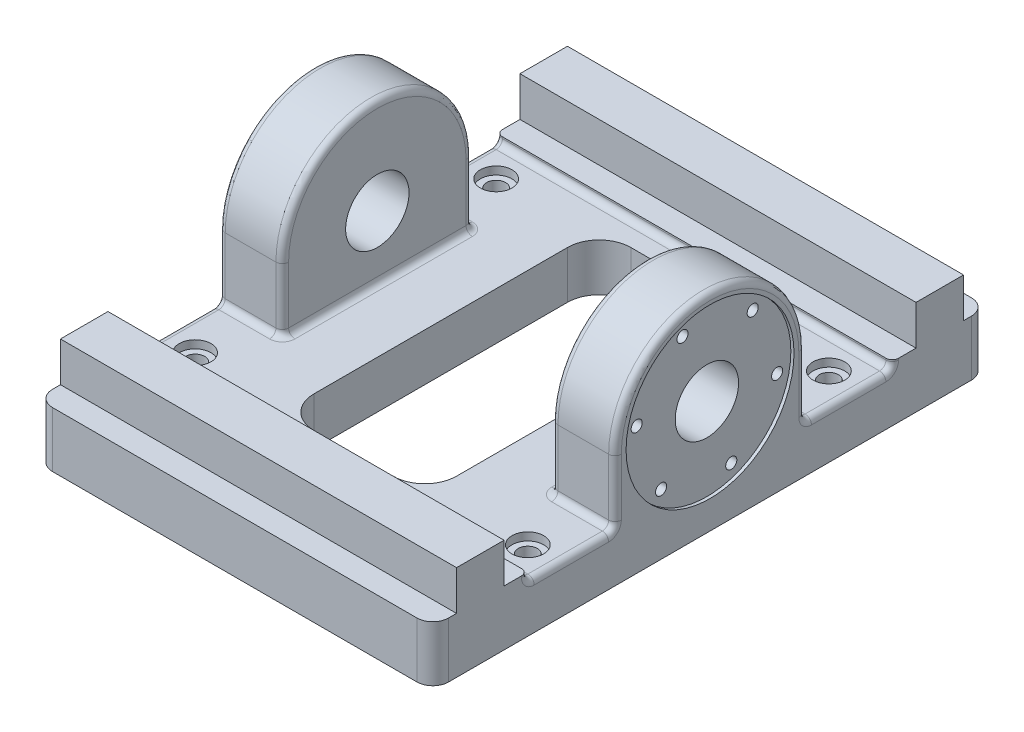
from build123d import *

# Parameters (mm, degrees)
SKETCH1_W               = 250
SKETCH1_H               = 350
BOSS_EXTRUDE1_DEPTH     = 30
SKETCH2_W               = 250
SKETCH2_H               = 30
BOSS_EXTRUDE2_DEPTH     = 30
SKETCH3_W               = 250
SKETCH3_H               = 60
BOSS_EXTRUDE3_DEPTH     = 5
BOSS_EXTRUDE4_DEPTH     = 40
SKETCH5_R               = 53
CUT_EXTRUDE1_DEPTH      = 2
SKETCH6_R               = 3.5
CUT_EXTRUDE2_DEPTH      = 30
CIRPATTERN1_COUNT       = 6
MIRROR2_COPY_1_SKETCH_R = 3.5
MIRROR2_COPY_1_DEPTH    = 30
MIRROR2_COPY_2_SKETCH_R = 3.5
MIRROR2_COPY_2_DEPTH    = 30
MIRROR2_COPY_3_SKETCH_R = 3.5
MIRROR2_COPY_3_DEPTH    = 30
MIRROR2_COPY_4_SKETCH_R = 3.5
MIRROR2_COPY_4_DEPTH    = 30
MIRROR2_COPY_5_SKETCH_R = 3.5
MIRROR2_COPY_5_DEPTH    = 30
CUT_EXTRUDE3_DEPTH      = 252.296637463
CUT_EXTRUDE3_DEPTH_BACK = 252.296637463
SKETCH7_R               = 20
CUT_EXTRUDE4_REACH      = 239.171
HOLE1_D                 = 12
HOLE1_CBORE_D           = 20
HOLE1_CBORE_DEPTH       = 5
LPATTERN1_COUNT         = 2
LPATTERN1_PITCH         = 190
LPATTERN1_COUNT_DIR2    = 2
LPATTERN1_PITCH_DIR2    = 210
FILLET1_R               = 10
FILLET2_R               = 4


with BuildPart() as part:
    # Sketch1 → Boss-Extrude1 (new body)
    with BuildSketch(Plane(origin=(0, 0, 0), x_dir=(1, 0, 0), z_dir=(0, 1, 0))):
        Rectangle(SKETCH1_W, SKETCH1_H)
    extrude(amount=BOSS_EXTRUDE1_DEPTH)

    # Sketch2 → Boss-Extrude2 (add)
    with BuildSketch(Plane(origin=(0, 30, 0), x_dir=(1, 0, 0), z_dir=(0, 1, 0))):
        with Locations((0, -145)):
            Rectangle(SKETCH2_W, SKETCH2_H)
    boss_extrude2 = extrude(amount=BOSS_EXTRUDE2_DEPTH)

    # Sketch3 → Boss-Extrude3 (add)
    with BuildSketch(Plane(origin=(0, 30, 0), x_dir=(1, 0, 0), z_dir=(0, 1, 0))):
        with Locations((0, -145)):
            Rectangle(SKETCH3_W, SKETCH3_H)
    boss_extrude3 = extrude(amount=BOSS_EXTRUDE3_DEPTH)

    # Mirror1: Boss-Extrude2, Boss-Extrude3 across plane
    add(boss_extrude2.mirror(Plane.XY))
    add(boss_extrude3.mirror(Plane.XY))

    # Sketch4 → Boss-Extrude4 (add)
    with BuildSketch(Plane.ZY.offset(125)):
        with BuildLine():
            Line((60, 30), (-60, 30))
            Line((-60, 30), (-60, 70))
            ThreePointArc((-60, 70), (0, 130), (60, 70))
            Line((60, 70), (60, 30))
        make_face()
    boss_extrude4 = extrude(amount=-BOSS_EXTRUDE4_DEPTH)

    # Sketch5 → Cut-Extrude1 (cut)
    with BuildSketch(Plane.ZY.offset(125)):
        with Locations((0, 70.778312247)):
            Circle(SKETCH5_R)
    cut_extrude1 = extrude(amount=-CUT_EXTRUDE1_DEPTH, mode=Mode.SUBTRACT)

    # Sketch6 → Cut-Extrude2 (cut)
    with BuildSketch(Plane.ZY.offset(125)):
        with Locations((15.39090645, 113.064480182)):
            Circle(SKETCH6_R)
    cut_extrude2 = extrude(amount=-CUT_EXTRUDE2_DEPTH, mode=Mode.SUBTRACT)

    # CirPattern1: Cut-Extrude2 ×6 about axis
    cirpattern1_axis = Axis((0, 70.778312247, 0), (1, 0, 0))
    for i in range(1, CIRPATTERN1_COUNT):
        add(cut_extrude2.rotate(cirpattern1_axis, i * 360 / CIRPATTERN1_COUNT), mode=Mode.SUBTRACT)

    # Mirror2: Boss-Extrude4, Cut-Extrude1, Cut-Extrude2 across plane
    add(boss_extrude4.mirror(Plane(origin=(0, 0, 0), x_dir=(0, 0, 1), z_dir=(1, 0, 0))))
    add(cut_extrude1.mirror(Plane(origin=(0, 0, 0), x_dir=(0, 0, 1), z_dir=(1, 0, 0))), mode=Mode.SUBTRACT)
    add(cut_extrude2.mirror(Plane(origin=(0, 0, 0), x_dir=(0, 0, 1), z_dir=(1, 0, 0))), mode=Mode.SUBTRACT)

    # Mirror2 copy 1 sketch → Mirror2 copy 1 (cut)
    with BuildSketch(Plane(origin=(125, 35.389156123, -61.295816443), x_dir=(0, -0.8660254037844386, 0.5000000000000001), z_dir=(1, 0, 0))):
        with Locations((15.39090645, -113.064480182)):
            Circle(MIRROR2_COPY_1_SKETCH_R)
    extrude(amount=-MIRROR2_COPY_1_DEPTH, mode=Mode.SUBTRACT)

    # Mirror2 copy 2 sketch → Mirror2 copy 2 (cut)
    with BuildSketch(Plane(origin=(125, 106.16746837, -61.295816443), x_dir=(0, -0.8660254037844387, -0.4999999999999998), z_dir=(1, 0, 0))):
        with Locations((15.39090645, -113.064480182)):
            Circle(MIRROR2_COPY_2_SKETCH_R)
    extrude(amount=-MIRROR2_COPY_2_DEPTH, mode=Mode.SUBTRACT)

    # Mirror2 copy 3 sketch → Mirror2 copy 3 (cut)
    with BuildSketch(Plane(origin=(125, 141.556624494, 0), x_dir=(0, 0, -1), z_dir=(1, 0, 0))):
        with Locations((15.39090645, -113.064480182)):
            Circle(MIRROR2_COPY_3_SKETCH_R)
    extrude(amount=-MIRROR2_COPY_3_DEPTH, mode=Mode.SUBTRACT)

    # Mirror2 copy 4 sketch → Mirror2 copy 4 (cut)
    with BuildSketch(Plane(origin=(125, 106.16746837, 61.295816443), x_dir=(0, 0.8660254037844384, -0.5000000000000004), z_dir=(1, 0, 0))):
        with Locations((15.39090645, -113.064480182)):
            Circle(MIRROR2_COPY_4_SKETCH_R)
    extrude(amount=-MIRROR2_COPY_4_DEPTH, mode=Mode.SUBTRACT)

    # Mirror2 copy 5 sketch → Mirror2 copy 5 (cut)
    with BuildSketch(Plane(origin=(125, 35.389156123, 61.295816443), x_dir=(0, 0.8660254037844386, 0.5000000000000001), z_dir=(1, 0, 0))):
        with Locations((15.39090645, -113.064480182)):
            Circle(MIRROR2_COPY_5_SKETCH_R)
    extrude(amount=-MIRROR2_COPY_5_DEPTH, mode=Mode.SUBTRACT)

    # Sketch7 → Cut-Extrude3 (cut, two sides: drawn at the far end of the back side and taken through both)
    with BuildSketch(Plane(origin=(0, 0, 0), x_dir=(0, 0, -1), z_dir=(1, 0, 0)).offset(-CUT_EXTRUDE3_DEPTH_BACK)):
        with Locations((0, 70)):
            Circle(SKETCH7_R)
    extrude(amount=CUT_EXTRUDE3_DEPTH + CUT_EXTRUDE3_DEPTH_BACK, mode=Mode.SUBTRACT)

    # Sketch8 → Cut-Extrude4 (cut, up to next)
    with BuildSketch(Plane(origin=(0, 30, 0), x_dir=(1, 0, 0), z_dir=(0, 1, 0)), mode=Mode.PRIVATE) as cut_extrude4_sk1:
        with BuildLine():
            Line((-25, 100), (25, 100))
            ThreePointArc((25, 100), (39.142135624, 94.142135624), (45, 80))
            Line((45, 80), (45, -80))
            ThreePointArc((45, -80), (39.142135624, -94.142135624), (25, -100))
            Line((25, -100), (-25, -100))
            ThreePointArc((-25, -100), (-39.142135624, -94.142135624), (-45, -80))
            Line((-45, -80), (-45, 80))
            ThreePointArc((-45, 80), (-39.142135624, 94.142135624), (-25, 100))
        make_face()
    cut_extrude4_tool1 = extrude(cut_extrude4_sk1.sketch, amount=-CUT_EXTRUDE4_REACH, mode=Mode.PRIVATE) & part.part
    add(cut_extrude4_tool1.solids().sort_by_distance((0, 30, 0))[0], mode=Mode.SUBTRACT)

    # Hole1 (through all)
    with Locations(Plane(origin=(0, 30, 0), x_dir=(-1, 0, 0), z_dir=(0, 1, 0))):
        with Locations((-105, -95)):
            hole1 = CounterBoreHole(HOLE1_D / 2, HOLE1_CBORE_D / 2, HOLE1_CBORE_DEPTH)

    # LPattern1: Hole1 2 × 2
    with Locations(*[(-j * LPATTERN1_PITCH_DIR2, 0, i * LPATTERN1_PITCH) for i in range(LPATTERN1_COUNT) for j in range(LPATTERN1_COUNT_DIR2) if (i, j) != (0, 0)]):
        add(hole1, mode=Mode.SUBTRACT)

    # Fillet1
    fillet1_edges = [part.edges().sort_by_distance(p)[0] for p in [
        (-125, 17.5, -175),
        (125, 17.5, -175),
        (125, 17.5, 175),
        (-125, 17.5, 175),
    ]]
    fillet(fillet1_edges, radius=FILLET1_R)

    # Fillet2
    fillet2_edges = [part.edges().sort_by_distance(p)[0] for p in [
        (125, 30, -87.5),
        (125, 50, 60),
        (105, 30, 60),
        (125, 130, 0),
        (125, 50, -60),
        (105, 30, -60),
        (85, 50, 60),
        (85, 130, 0),
        (85, 50, -60),
        (85, 30, 0),
        (125, 30, 87.5),
        (-125, 32.5, 115),
        (0, 30, 115),
        (125, 32.5, 115),
        (-125, 30, -87.5),
        (125, 32.5, -115),
        (0, 30, -115),
        (-125, 32.5, -115),
        (-125, 30, 87.5),
        (-85, 50, 60),
        (-85, 30, 0),
        (-105, 30, 60),
        (-85, 50, -60),
        (-105, 30, -60),
        (-85, 130, 0),
        (-125, 50, 60),
        (-125, 130, 0),
        (-125, 50, -60),
    ]]
    fillet(fillet2_edges, radius=FILLET2_R)


solid = part.part
